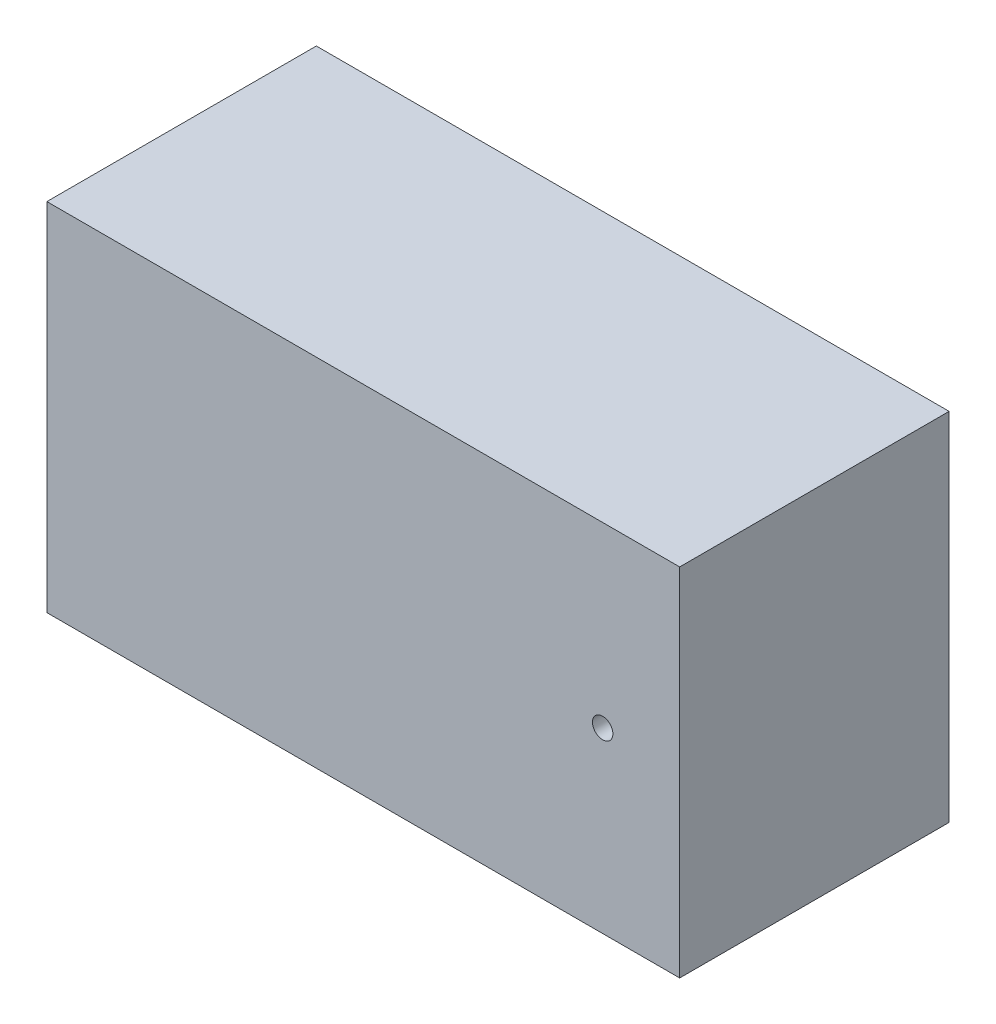
from build123d import *

# Parameters (mm, degrees)
IZIM1_W                     = 155
IZIM1_H                     = 87.2
Y_KSEKLIK_EKSTR_ZYON1_DEPTH = 66
IZIM2_R                     = 2.5
KES_EKSTR_ZYON1_DEPTH       = 111.739378723
IZIM3_W                     = 40
IZIM3_H                     = 40
KES_EKSTR_ZYON2_DEPTH       = 112


with BuildPart() as part:
    # Çizim1 → Yükseklik-Ekstrüzyon1 (new body)
    with BuildSketch(Plane.XY):
        Rectangle(IZIM1_W, IZIM1_H)
    extrude(amount=Y_KSEKLIK_EKSTR_ZYON1_DEPTH)

    # Çizim2 → Kes-Ekstrüzyon1 (cut, through all)
    with BuildSketch(Plane.XY.offset(66)):
        with Locations((58.64, 0)):
            Circle(IZIM2_R)
    extrude(amount=-KES_EKSTR_ZYON1_DEPTH, mode=Mode.SUBTRACT)

    # Çizim3 → Kes-Ekstrüzyon2 (cut)
    with BuildSketch(Plane.ZY.offset(77.5)):
        with Locations((33, 0)):
            Rectangle(IZIM3_W, IZIM3_H)
    extrude(amount=-KES_EKSTR_ZYON2_DEPTH, mode=Mode.SUBTRACT)


solid = part.part
